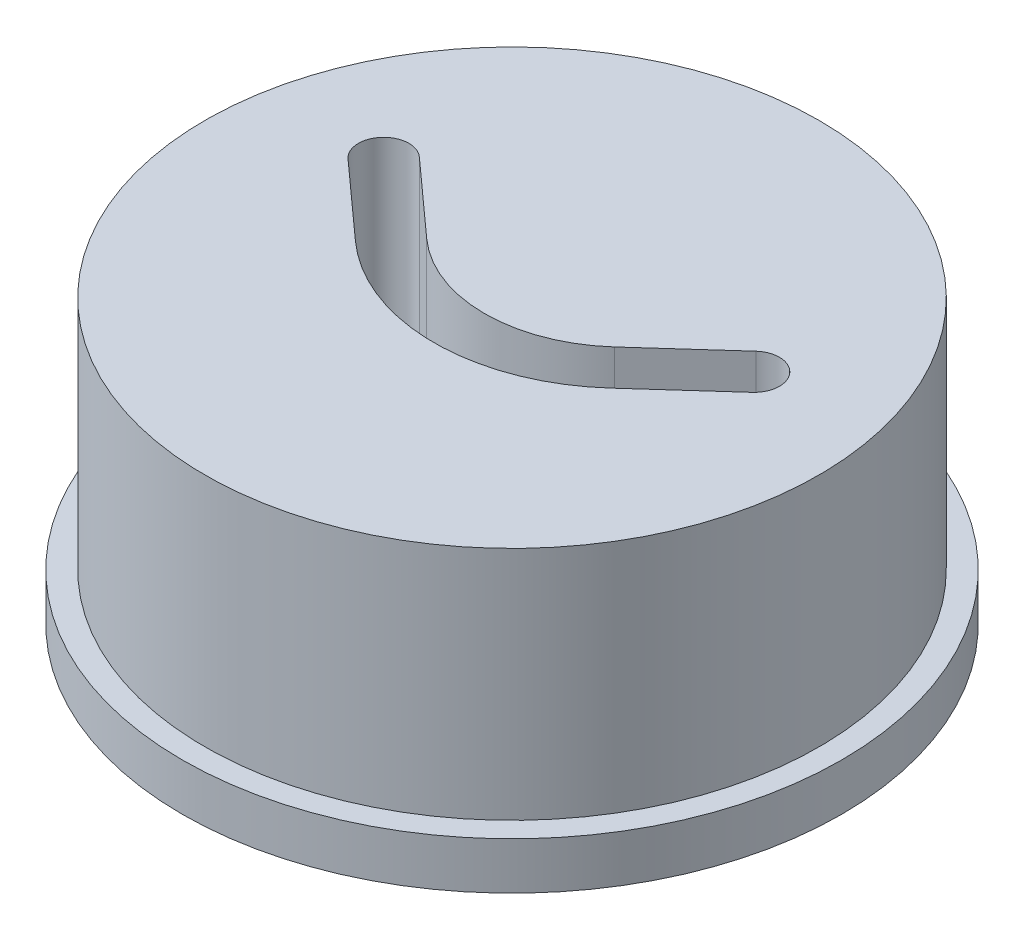
from build123d import *

# Parameters (mm, degrees)
SKETCH2_R           = 20.701
BOSS_EXTRUDE1_DEPTH = 19.05
CUT_EXTRUDE2_DEPTH  = 12.7
SKETCH15_R          = 22.225
BOSS_EXTRUDE2_DEPTH = 3.175


with BuildPart() as part:
    # Sketch2 → Boss-Extrude1 (new body)
    with BuildSketch(Plane(origin=(0, 0, 0), x_dir=(1, 0, 0), z_dir=(0, 1, 0))):
        with Locations(Location((0, 0, 0), (0, 0, 90))):
            Circle(SKETCH2_R)
        with BuildLine():
            Line((-13.081, 3.175), (-8.059107313, -1.349826056))
            ThreePointArc((-8.059107313, -1.349826056), (0, -4.445), (8.059107313, -1.349826056))
            Line((8.059107313, -1.349826056), (13.081, 3.175))
            ThreePointArc((13.081, 3.175), (13.146371637, 4.430535164), (11.890836473, 4.495906802))
            Line((11.890836473, 4.495906802), (6.868943786, -0.028919255))
            ThreePointArc((6.868943786, -0.028919255), (0, -2.667), (-6.868943786, -0.028919255))
            Line((-6.868943786, -0.028919255), (-11.890836473, 4.495906802))
            ThreePointArc((-11.890836473, 4.495906802), (-13.146371637, 4.430535164), (-13.081, 3.175))
        make_face(mode=Mode.SUBTRACT)
    extrude(amount=BOSS_EXTRUDE1_DEPTH)

    # Sketch14 → Cut-Extrude2 (cut)
    with BuildSketch(Plane(origin=(0, 19.05, 0), x_dir=(1, 0, 0), z_dir=(0, 1, 0))):
        with BuildLine():
            Line((8.603182068, -1.953669166), (13.625074755, 2.571156891))
            ThreePointArc((13.625074755, 2.571156891), (13.750214746, 4.97460992), (11.346761717, 5.099749911))
            Line((11.346761717, 5.099749911), (6.32486903, 0.574923855))
            ThreePointArc((6.32486903, 0.574923855), (0, -1.8542), (-6.32486903, 0.574923855))
            Line((-6.32486903, 0.574923855), (-11.346761717, 5.099749911))
            ThreePointArc((-11.346761717, 5.099749911), (-13.750214746, 4.97460992), (-13.625074755, 2.571156891))
            Line((-13.625074755, 2.571156891), (-8.603182068, -1.953669166))
            ThreePointArc((-8.603182068, -1.953669166), (0, -5.2578), (8.603182068, -1.953669166))
        make_face()
    extrude(amount=-CUT_EXTRUDE2_DEPTH, mode=Mode.SUBTRACT)

    # Sketch15 → Boss-Extrude2 (add)
    with BuildSketch(Plane.XZ):
        with Locations(Location((0, 0, 0), (0, 0, 270))):
            Circle(SKETCH15_R)
        with BuildLine():
            Line((-13.081, -3.175), (-8.059107313, 1.349826056))
            ThreePointArc((-8.059107313, 1.349826056), (0, 4.445), (8.059107313, 1.349826056))
            Line((8.059107313, 1.349826056), (13.081, -3.175))
            ThreePointArc((13.081, -3.175), (13.146371637, -4.430535164), (11.890836473, -4.495906802))
            Line((11.890836473, -4.495906802), (6.868943786, 0.028919255))
            ThreePointArc((6.868943786, 0.028919255), (0, 2.667), (-6.868943786, 0.028919255))
            Line((-6.868943786, 0.028919255), (-11.890836473, -4.495906802))
            ThreePointArc((-11.890836473, -4.495906802), (-13.146371637, -4.430535164), (-13.081, -3.175))
        make_face(mode=Mode.SUBTRACT)
    extrude(amount=-BOSS_EXTRUDE2_DEPTH)


solid = part.part
